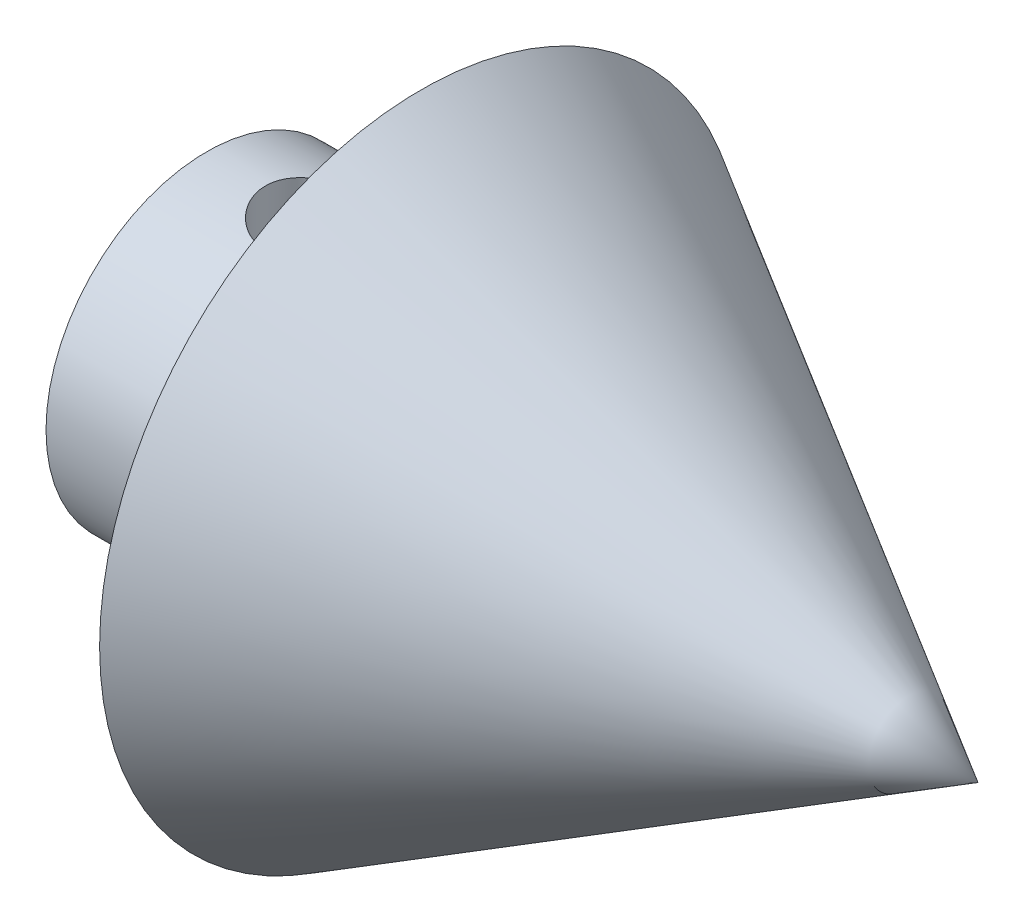
from build123d import *

# Parameters (mm, degrees)
CROQUIS1_R              = 7.5
SALIENTE_EXTRUIR1_DEPTH = 10
CROQUIS5_R              = 4.05
CORTAR_EXTRUIR1_DEPTH   = 15
CROQUIS9_W              = 2.2479
CROQUIS9_H              = 7.5


with BuildPart() as part:
    # Croquis1 → Saliente-Extruir1 (new body)
    with BuildSketch(Plane(origin=(0, 0, 0), x_dir=(0, 0, -1), z_dir=(1, 0, 0))):
        Circle(CROQUIS1_R)
    extrude(amount=SALIENTE_EXTRUIR1_DEPTH)


with BuildPart() as body_2:
    # Saliente-Extruir2 cone 1 section (through the dimple's axis) → Saliente-Extruir2 (revolve)
    with BuildSketch(Plane(origin=(10, 0, 0), x_dir=(0, 0, 1), z_dir=(0, 1, 0))):
        Polygon((0, 0), (15, 0), (0, 25.980762114), align=None)
    revolve(axis=Axis((10, 0, 0), (1, 0, 0)))


with BuildPart() as cortar_extruir1_tool:
    # Croquis5 → Cortar-Extruir1 (new body)
    with BuildSketch(Plane.ZY):
        Circle(CROQUIS5_R)
    extrude(amount=-CORTAR_EXTRUIR1_DEPTH)


with BuildPart() as part_1:
    add(part.part)

    # Cortar-Extruir1: cut by cortar_extruir1_tool
    add(cortar_extruir1_tool.part, mode=Mode.SUBTRACT)

    # Croquis9 → Taladro de margen para #81 (revolve, cut)
    with BuildSketch(Plane(origin=(4.999975966, 7.499983977, 0.015502848), x_dir=(0, -0.002067046378874128, 0.999997863657352), z_dir=(1, 0, 0))):
        with Locations((1.12395, 3.75)):
            Rectangle(CROQUIS9_W, CROQUIS9_H)
    revolve(axis=Axis((4.999975966, 13.849970412, 0.028628592), (0, -0.9999978636573518, -0.0020670463788741277)), mode=Mode.SUBTRACT)


with BuildPart() as body_2_1:
    add(body_2.part)

    # Cortar-Extruir1: cut by cortar_extruir1_tool
    add(cortar_extruir1_tool.part, mode=Mode.SUBTRACT)


solid = Compound([part_1.part, body_2_1.part])
